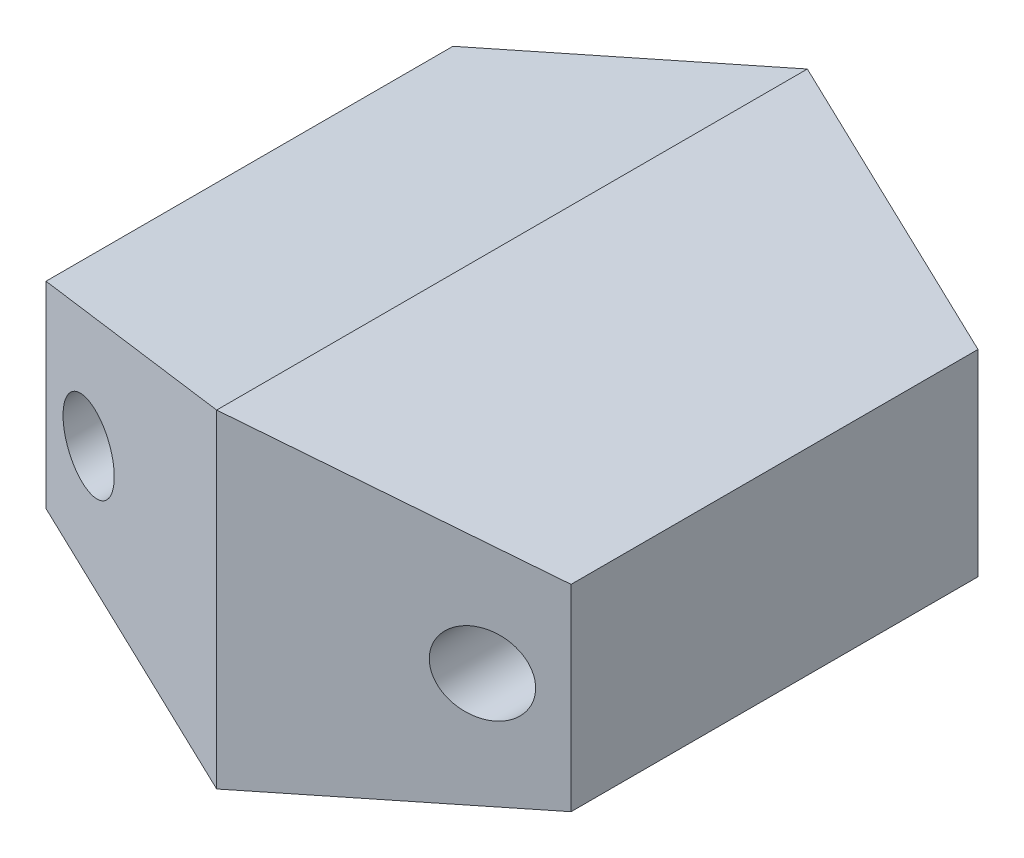
from build123d import *

# Parameters (mm, degrees)
SKETCH1_W           = 40
SKETCH1_H           = 25
BOSS_EXTRUDE1_DEPTH = 45
CUT_EXTRUDE1_DEPTH  = 45
CUT_EXTRUDE2_DEPTH  = 45
SKETCH4_R           = 3
CUT_EXTRUDE3_DEPTH  = 51.806003582


with BuildPart() as part:
    # Sketch1 → Boss-Extrude1 (new body)
    with BuildSketch(Plane.XY):
        Rectangle(SKETCH1_W, SKETCH1_H)
    extrude(amount=BOSS_EXTRUDE1_DEPTH)

    # Sketch2 → Cut-Extrude1 (cut)
    with BuildSketch(Plane(origin=(0, 12.5, 0), x_dir=(1, 0, 0), z_dir=(0, 1, 0))):
        Polygon((0, -45), (-20, -38), (-20, -45), align=None)
        Polygon((20, -45), (20, -38), (0, -45), align=None)
        Polygon((20, 0), (0, 0), (20, -7), align=None)
        Polygon((0, 0), (-20, -7), (-20, 0), align=None)
    extrude(amount=-CUT_EXTRUDE1_DEPTH, mode=Mode.SUBTRACT)

    # Sketch3 → Cut-Extrude2 (cut)
    with BuildSketch(Plane.XY):
        Polygon((-20, 12.5), (0, 12.5), (-20, 7.5), align=None)
        Polygon((20, 12.5), (20, 7.5), (0, 12.5), align=None)
        Polygon((20, -12.5), (0, -12.5), (20, -7.5), align=None)
        Polygon((-20, -12.5), (-20, -7.5), (0, -12.5), align=None)
    extrude(amount=CUT_EXTRUDE2_DEPTH, mode=Mode.SUBTRACT)

    # Sketch4 → Cut-Extrude3 (cut, through all)
    with BuildSketch(Plane.XY):
        with Locations(Location((-15, 0, 0), (0, 0, 180))):
            Circle(SKETCH4_R)
        with Locations(Location((15, 0, 0), (0, 0, 180))):
            Circle(SKETCH4_R)
    extrude(amount=CUT_EXTRUDE3_DEPTH, mode=Mode.SUBTRACT)


solid = part.part
